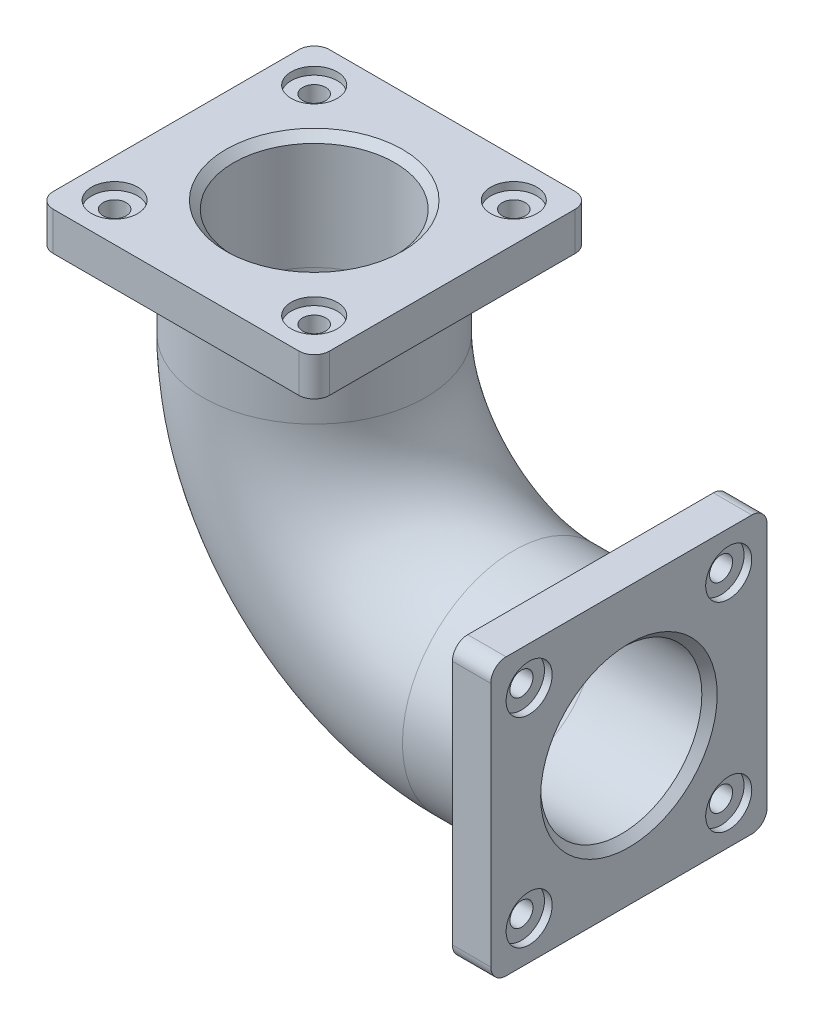
from build123d import *

# Parameters (mm, degrees)
SKETCH2_R           = 145
SKETCH2_R_2         = 105
BOSS_EXTRUDE1_START = -50
SKETCH6_R           = 15
SKETCH6_R_2         = 145
BOSS_EXTRUDE1_DEPTH = 50
CHAMFER1_SIZE       = 10
FILLET1_R           = 10
SKETCH7_R           = 15
SKETCH7_R_2         = 145
BOSS_EXTRUDE2_DEPTH = 50
CHAMFER2_SIZE       = 10
FILLET2_R           = 10
SKETCH9_R           = 30
CUT_EXTRUDE1_DEPTH  = 10
SKETCH10_R          = 30
CUT_EXTRUDE2_DEPTH  = 10


with BuildPart() as part:
    # Sweep1: sweep along a path in Sketch1
    with BuildLine(Plane.XY) as sweep1_path:
        Line((0, 0), (-150, 0))
        ThreePointArc((-150, 0), (-333.847763109, 76.152236891), (-410, 260))
        Line((-410, 260), (-410, 410))
    # Sketch2 → Sweep1 (sweep)
    with BuildSketch(Plane(origin=(-410, 410, 0), x_dir=(1, 0, 0), z_dir=(0, 1, 0))):
        Circle(SKETCH2_R)
        Circle(SKETCH2_R_2, mode=Mode.SUBTRACT)
    sweep(path=sweep1_path.line)

    # Sketch6 → Boss-Extrude1 (add)
    with BuildSketch(Plane(origin=(0, 0, 0), x_dir=(0, 0, -1), z_dir=(1, 0, 0)).offset(BOSS_EXTRUDE1_START)):
        with BuildLine():
            Line((-160, -180), (160, -180))
            ThreePointArc((160, -180), (174.142135624, -174.142135624), (180, -160))
            Line((180, -160), (180, 160))
            ThreePointArc((180, 160), (174.142135624, 174.142135624), (160, 180))
            Line((160, 180), (-160, 180))
            ThreePointArc((-160, 180), (-174.142135624, 174.142135624), (-180, 160))
            Line((-180, 160), (-180, -160))
            ThreePointArc((-180, -160), (-174.142135624, -174.142135624), (-160, -180))
        make_face()
        with Locations((130, 130)):
            Circle(SKETCH6_R, mode=Mode.SUBTRACT)
        with Locations((130, -130)):
            Circle(SKETCH6_R, mode=Mode.SUBTRACT)
        with Locations((-130, -130)):
            Circle(SKETCH6_R, mode=Mode.SUBTRACT)
        with Locations((-130, 130)):
            Circle(SKETCH6_R, mode=Mode.SUBTRACT)
        with Locations(Location((0, 0, 0), (0, 0, 270))):
            Circle(SKETCH6_R_2, mode=Mode.SUBTRACT)
    extrude(amount=BOSS_EXTRUDE1_DEPTH)

    # Chamfer1
    chamfer1_edges = [part.edges().sort_by_distance(p)[0] for p in [
        (0, -105, 0),
    ]]
    chamfer(chamfer1_edges, length=CHAMFER1_SIZE)

    # Fillet1
    fillet1_edges = [part.edges().sort_by_distance(p)[0] for p in [
        (-50, -145, 0),
    ]]
    fillet(fillet1_edges, radius=FILLET1_R)

    # Sketch7 → Boss-Extrude2 (add)
    with BuildSketch(Plane(origin=(0, 410, 0), x_dir=(1, 0, 0), z_dir=(0, 1, 0))):
        with BuildLine():
            Line((-570, -180), (-250, -180))
            ThreePointArc((-250, -180), (-235.857864376, -174.142135624), (-230, -160))
            Line((-230, -160), (-230, 160))
            ThreePointArc((-230, 160), (-235.857864376, 174.142135624), (-250, 180))
            Line((-250, 180), (-570, 180))
            ThreePointArc((-570, 180), (-584.142135624, 174.142135624), (-590, 160))
            Line((-590, 160), (-590, -160))
            ThreePointArc((-590, -160), (-584.142135624, -174.142135624), (-570, -180))
        make_face()
        with Locations(Location((-540, 130, 0), (0, 0, 180))):
            Circle(SKETCH7_R, mode=Mode.SUBTRACT)
        with Locations(Location((-540, -130, 0), (0, 0, 180))):
            Circle(SKETCH7_R, mode=Mode.SUBTRACT)
        with Locations(Location((-280, -130, 0), (0, 0, 180))):
            Circle(SKETCH7_R, mode=Mode.SUBTRACT)
        with Locations(Location((-280, 130, 0), (0, 0, 180))):
            Circle(SKETCH7_R, mode=Mode.SUBTRACT)
        with Locations(Location((-410, 0, 0), (0, 0, 180))):
            Circle(SKETCH7_R_2, mode=Mode.SUBTRACT)
    extrude(amount=-BOSS_EXTRUDE2_DEPTH)

    # Chamfer2
    chamfer2_edges = [part.edges().sort_by_distance(p)[0] for p in [
        (-515, 410, 0),
    ]]
    chamfer(chamfer2_edges, length=CHAMFER2_SIZE)

    # Fillet2
    fillet2_edges = [part.edges().sort_by_distance(p)[0] for p in [
        (-555, 360, 0),
    ]]
    fillet(fillet2_edges, radius=FILLET2_R)

    # Sketch9 → Cut-Extrude1 (cut)
    with BuildSketch(Plane(origin=(0, 410, 0), x_dir=(1, 0, 0), z_dir=(0, 1, 0))):
        with Locations(Location((-540, 130, 0), (0, 0, 180))):
            Circle(SKETCH9_R)
        with Locations(Location((-280, 130, 0), (0, 0, 180))):
            Circle(SKETCH9_R)
        with Locations(Location((-540, -130, 0), (0, 0, 180))):
            Circle(SKETCH9_R)
        with Locations(Location((-280, -130, 0), (0, 0, 180))):
            Circle(SKETCH9_R)
    extrude(amount=-CUT_EXTRUDE1_DEPTH, mode=Mode.SUBTRACT)

    # Sketch10 → Cut-Extrude2 (cut)
    with BuildSketch(Plane(origin=(0, 0, 0), x_dir=(0, 0, -1), z_dir=(1, 0, 0))):
        with Locations((-130, 130)):
            Circle(SKETCH10_R)
        with Locations((130, 130)):
            Circle(SKETCH10_R)
        with Locations((-130, -130)):
            Circle(SKETCH10_R)
        with Locations((130, -130)):
            Circle(SKETCH10_R)
    extrude(amount=-CUT_EXTRUDE2_DEPTH, mode=Mode.SUBTRACT)


solid = part.part
